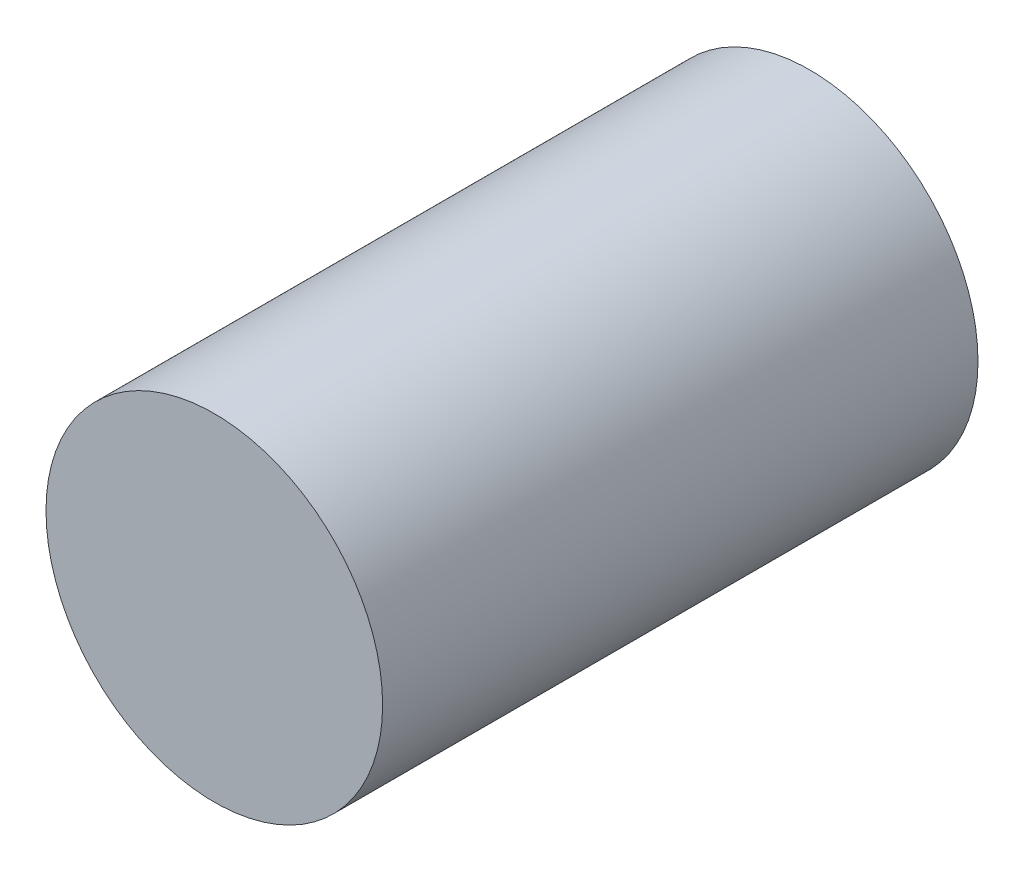
from build123d import *

# Parameters (mm, degrees)
SKETCH1_R           = 33
BOSS_EXTRUDE1_DEPTH = 116.74


with BuildPart() as part:
    # Sketch1 → Boss-Extrude1 (new body)
    with BuildSketch(Plane.XY):
        Circle(SKETCH1_R)
    extrude(amount=BOSS_EXTRUDE1_DEPTH)


solid = part.part
